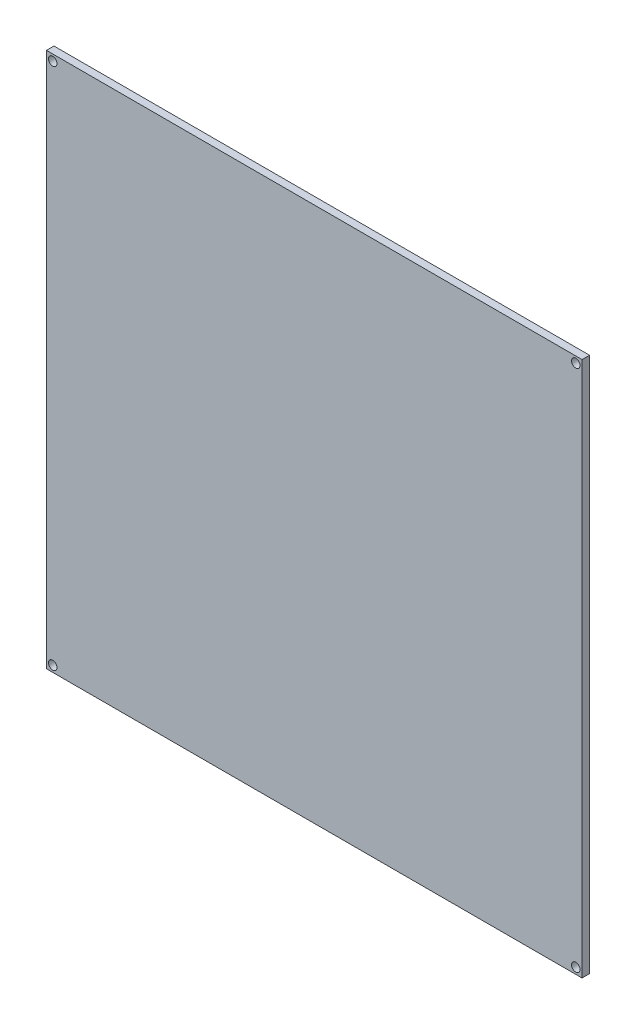
from build123d import *

# Parameters (mm, degrees)
SCHIZZO1_W                   = 214
SCHIZZO1_H                   = 214
ESTRUSIONE_ESTRUSIONE1_DEPTH = 3
FORO_PER_VITE_M3_1_D         = 3.4


with BuildPart() as part:
    # Schizzo1 → Estrusione-Estrusione1 (new body)
    with BuildSketch(Plane.XY):
        with Locations((-107, 107)):
            Rectangle(SCHIZZO1_W, SCHIZZO1_H)
    extrude(amount=-ESTRUSIONE_ESTRUSIONE1_DEPTH)

    # Foro per Vite M3-1 (through all)
    with Locations(Plane.XY):
        with Locations((-2.5, 211.5), (-2.5, 2.5), (-211.5, 211.5), (-211.5, 2.5)):
            Hole(FORO_PER_VITE_M3_1_D / 2)


solid = part.part
